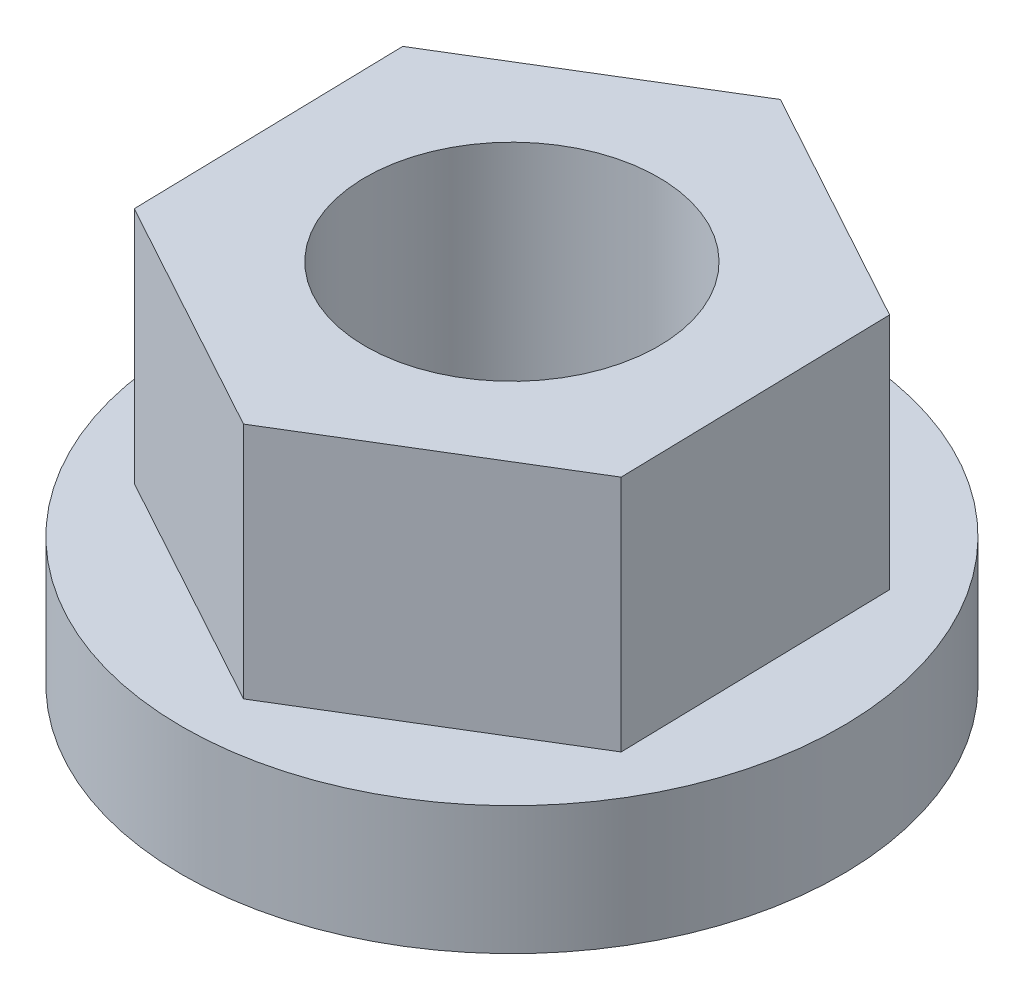
from build123d import *

# Parameters (mm, degrees)
SKETCH_1_R          = 9
SKETCH_1_R_2        = 4
EXTRUDE_1_DEPTH     = 10
SKETCH_2_R          = 9.49914793
CUT_EXTRUDE_2_DEPTH = 6.5


with BuildPart() as part:
    # 草图1 → 拉伸1 (new body)
    with BuildSketch(Plane(origin=(0, 0, 0), x_dir=(1, 0, 0), z_dir=(0, 1, 0))):
        with Locations(Location((0, 0, 0), (0, 0, 270))):
            Circle(SKETCH_1_R)
        with Locations(Location((0, 0, 0), (0, 0, 270))):
            Circle(SKETCH_1_R_2, mode=Mode.SUBTRACT)
    extrude(amount=EXTRUDE_1_DEPTH)

    # 草图2 → 拉伸2 (cut)
    with BuildSketch(Plane(origin=(0, 10, 0), x_dir=(1, 0, 0), z_dir=(0, 1, 0))):
        Circle(SKETCH_2_R)
        Polygon((6.584703233, -3.602085044), (6.411848771, 3.901477754), (-0.172854462, 7.503562798), (-6.584703233, 3.602085044), (-6.411848771, -3.901477754), (0.172854462, -7.503562798), align=None, mode=Mode.SUBTRACT)
    extrude(amount=-CUT_EXTRUDE_2_DEPTH, mode=Mode.SUBTRACT)


solid = part.part
